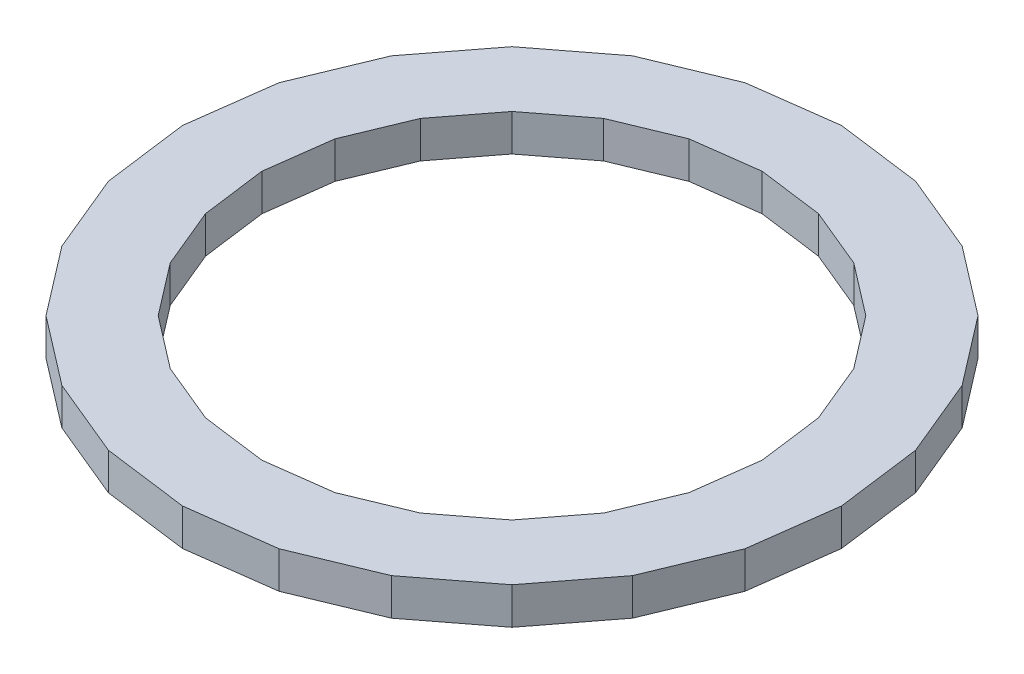
from build123d import *

# Parameters (mm, degrees)
BOSS_EXTRUDE2_DEPTH = 19.05


with BuildPart() as part:
    # Sketch2 → Boss-Extrude2 (new body)
    with BuildSketch(Plane(origin=(0, 0, 0), x_dir=(1, 0, 0), z_dir=(0, 1, 0))):
        Polygon((-170.272338616, 0), (-164.470449372, -44.069724088), (-147.460170804, -85.136169308), (-120.400725284, -120.400725284), (-85.136169308, -147.460170804), (-44.069724088, -164.470449372), (0, -170.272338616), (44.069724088, -164.470449372), (85.136169308, -147.460170804), (120.400725284, -120.400725284), (147.460170804, -85.136169308), (164.470449372, -44.069724088), (170.272338616, 0), (164.470449372, 44.069724088), (147.460170804, 85.136169308), (120.400725284, 120.400725284), (85.136169308, 147.460170804), (44.069724088, 164.470449372), (0, 170.272338616), (-44.069724088, 164.470449372), (-85.136169308, 147.460170804), (-120.400725284, 120.400725284), (-147.460170804, 85.136169308), (-164.470449372, 44.069724088), align=None)
        Polygon((-129.281657658, 0), (-124.876491998, -33.460555184), (-111.961199776, -64.640828829), (-91.415936813, -91.415936813), (-64.640828829, -111.961199776), (-33.460555184, -124.876491998), (0, -129.281657658), (33.460555184, -124.876491998), (64.640828829, -111.961199776), (91.415936813, -91.415936813), (111.961199776, -64.640828829), (124.876491998, -33.460555184), (129.281657658, 0), (124.876491998, 33.460555184), (111.961199776, 64.640828829), (91.415936813, 91.415936813), (64.640828829, 111.961199776), (33.460555184, 124.876491998), (0, 129.281657658), (-33.460555184, 124.876491998), (-64.640828829, 111.961199776), (-91.415936813, 91.415936813), (-111.961199776, 64.640828829), (-124.876491998, 33.460555184), align=None, mode=Mode.SUBTRACT)
    extrude(amount=BOSS_EXTRUDE2_DEPTH)


solid = part.part
